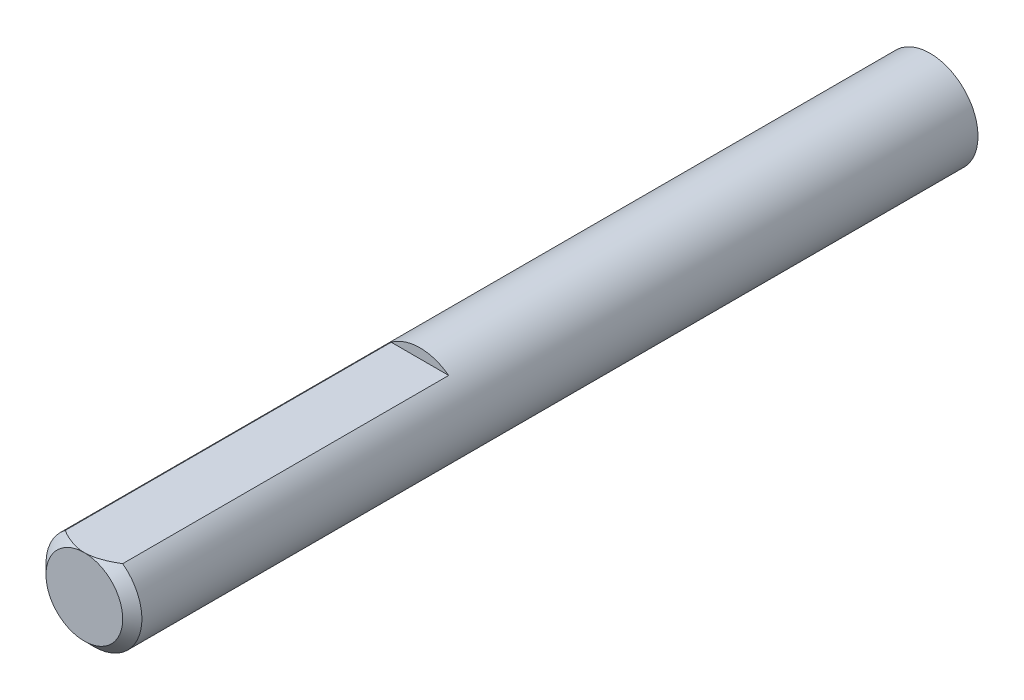
from build123d import *

# Parameters (mm, degrees)
CROQUIS1_R              = 2.5
SALIENTE_EXTRUIR1_DEPTH = 44.1
REDONDEO1_SIZE          = 0.5
SKETCH_1_W              = 5.27274558
SKETCH_1_H              = 1.959781543
CUT_EXTRUDE_1_DEPTH     = 17.5


with BuildPart() as part:
    # Croquis1 → Saliente-Extruir1 (new body)
    with BuildSketch(Plane.XY):
        Circle(CROQUIS1_R)
    extrude(amount=SALIENTE_EXTRUIR1_DEPTH)

    # Redondeo1
    redondeo1_edges = [part.edges().sort_by_distance(p)[0] for p in [
        (-2.5, 0, 44.1),
    ]]
    chamfer(redondeo1_edges, length=REDONDEO1_SIZE)

    # Эскиз1 → Вырез-Вытянуть1 (cut)
    with BuildSketch(Plane.XY.offset(44.1)):
        with Locations((0.092224381, 2.979890772)):
            Rectangle(SKETCH_1_W, SKETCH_1_H)
    extrude(amount=-CUT_EXTRUDE_1_DEPTH, mode=Mode.SUBTRACT)


solid = part.part
